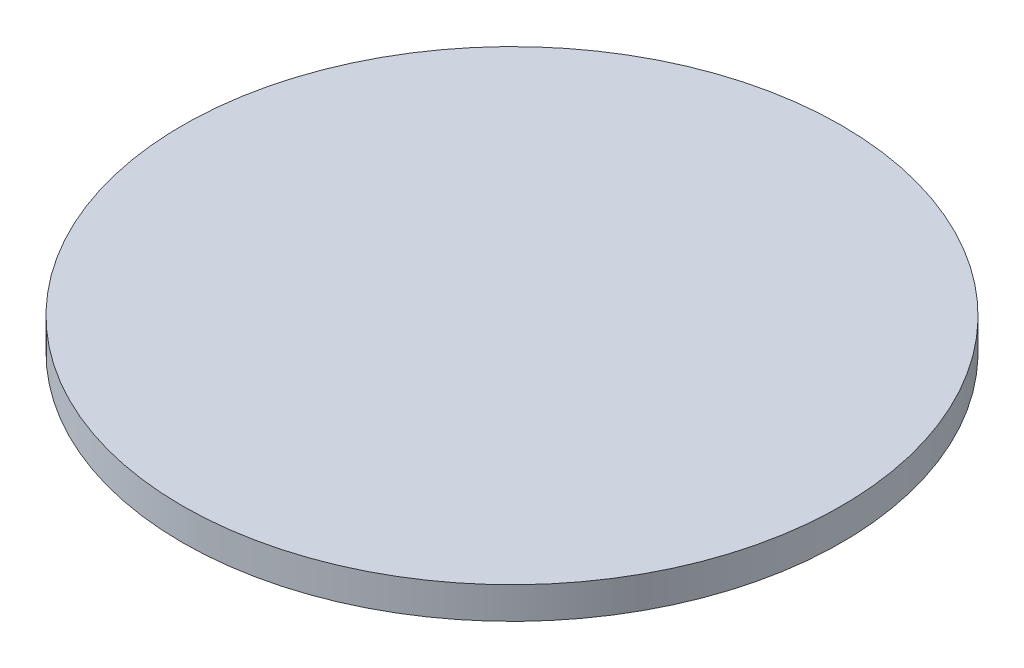
from build123d import *

# Parameters (mm, degrees)
SKETCH1_R           = 10.375
BOSS_EXTRUDE1_DEPTH = 1


with BuildPart() as part:
    # Sketch1 → Boss-Extrude1 (new body)
    with BuildSketch(Plane(origin=(0, 0, 0), x_dir=(1, 0, 0), z_dir=(0, 1, 0))):
        with Locations(Location((0, 0, 0), (0, 0, 270))):
            Circle(SKETCH1_R)
    extrude(amount=BOSS_EXTRUDE1_DEPTH)


solid = part.part
